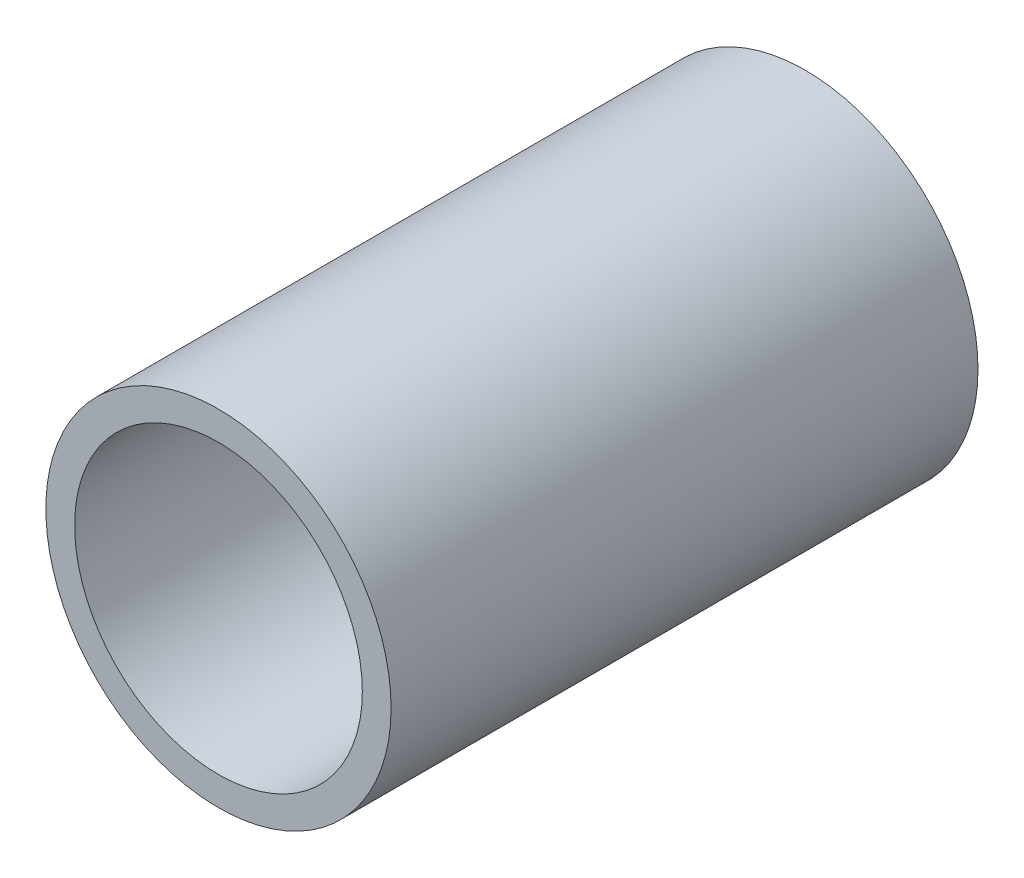
from build123d import *

# Parameters (mm, degrees)
CROQUIS1_R              = 15
SALIENTE_EXTRUIR1_DEPTH = 51
CROQUIS2_R              = 12.5
CORTAR_EXTRUIR1_DEPTH   = 47


with BuildPart() as part:
    # Croquis1 → Saliente-Extruir1 (new body)
    with BuildSketch(Plane.XY):
        Circle(CROQUIS1_R)
    extrude(amount=SALIENTE_EXTRUIR1_DEPTH)

    # Croquis2 → Cortar-Extruir1 (cut)
    with BuildSketch(Plane.XY.offset(51)):
        Circle(CROQUIS2_R)
    extrude(amount=-CORTAR_EXTRUIR1_DEPTH, mode=Mode.SUBTRACT)


solid = part.part
